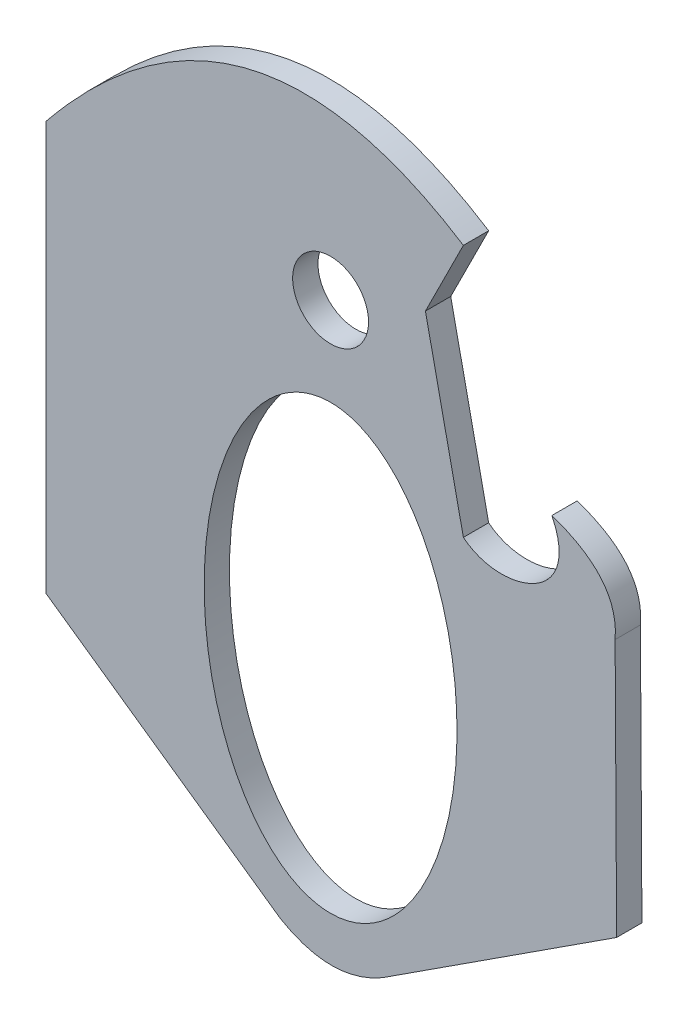
from build123d import *

# Parameters (mm, degrees)
BOSS_EXTRUDE1_DEPTH = 2
SKETCH2_R           = 3
CUT_EXTRUDE1_DEPTH  = 44.941077942
SKETCH3_RX          = 17.5
SKETCH3_RY          = 10
CUT_EXTRUDE2_DEPTH  = 44.941077942


with BuildPart() as part:
    # Sketch1 → Boss-Extrude1 (new body)
    with BuildSketch(Plane.XY):
        with BuildLine():
            Line((10.5, 33.5), (7.5, 27.5))
            Line((7.5, 27.5), (10.5, 13.5))
            add(Edge.make_bspline(
                [(10.5, 13.5), (13.496182411, 11.027569171), (20.037267901, 13.306377108), (17.5, 18.5)],
                knots=[0, 0, 0, 0, 1, 1, 1, 1], degree=3))
            add(Edge.make_bspline(
                [(17.5, 18.5), (22.853553391, 16.681980515), (22.5, 12.5)],
                knots=[0, 0, 0, 1, 1, 1], degree=2))
            Line((22.5, 12.5), (22.62041986, -7.841479807))
            Line((22.62041986, -7.841479807), (4.12041986, -19.841479807))
            add(Edge.make_bspline(
                [(-3.970513587, -19.841479807), (0.071073188, -22.212443979), (4.12041986, -19.841479807)],
                knots=[0, 0, 0, 1, 1, 1], degree=2))
            Line((-3.970513587, -19.841479807), (-22.5, -6.845777179))
            Line((-22.5, -6.845777179), (-22.5, -4.500101611))
            Line((-22.5, -4.500101611), (-22.5, 25.5))
            add(Edge.make_bspline(
                [(-22.5, 25.5), (-6.957614564, 44.682729257), (10.5, 33.5)],
                knots=[0, 0, 0, 1, 1, 1], degree=2))
        make_face()
    extrude(amount=BOSS_EXTRUDE1_DEPTH)

    # Sketch2 → Cut-Extrude1 (cut, through all)
    with BuildSketch(Plane.XY.offset(2)):
        with Locations((0, 24.5)):
            Circle(SKETCH2_R)
    extrude(amount=-CUT_EXTRUDE1_DEPTH, mode=Mode.SUBTRACT)

    # Sketch3 → Cut-Extrude2 (cut, through all)
    with BuildSketch(Plane.XY.offset(2)):
        with Locations(Location((0, 0), (0, 0, -90))):
            Ellipse(SKETCH3_RX, SKETCH3_RY)
    extrude(amount=-CUT_EXTRUDE2_DEPTH, mode=Mode.SUBTRACT)


solid = part.part
